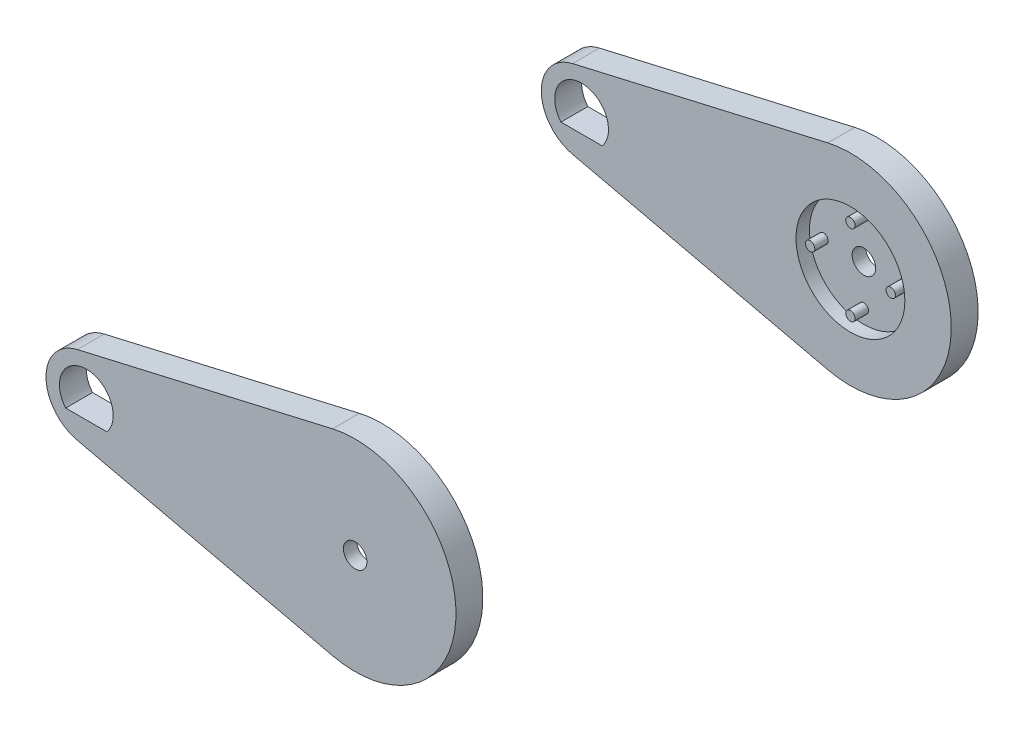
from build123d import *

# Parameters (mm, degrees)
SKETCH1_R           = 15
SKETCH1_R_2         = 8.1
BOSS_EXTRUDE1_DEPTH = 4
SKETCH1_3_R         = 8.1
SKETCH1_3_R_2       = 1.75
BOSS_EXTRUDE2_DEPTH = 2
BOSS_EXTRUDE3_DEPTH = 4
SKETCH3_R           = 0.7
BOSS_EXTRUDE4_DEPTH = 2


with BuildPart() as part:
    # Sketch1 → Boss-Extrude1 (new body)
    with BuildSketch(Plane.XY):
        Circle(SKETCH1_R)
        Circle(SKETCH1_R_2, mode=Mode.SUBTRACT)
    extrude(amount=BOSS_EXTRUDE1_DEPTH)

    # Sketch1<3> → Boss-Extrude2 (add)
    with BuildSketch(Plane.XY):
        Circle(SKETCH1_3_R)
        Circle(SKETCH1_3_R_2, mode=Mode.SUBTRACT)
    extrude(amount=BOSS_EXTRUDE2_DEPTH)

    # Sketch2 → Boss-Extrude3 (add)
    with BuildSketch(Plane.XY):
        with BuildLine():
            Line((-3.375, 14.615381452), (-41.35, 5.846152581))
            ThreePointArc((-41.35, 5.846152581), (-46, 0), (-41.35, -5.846152581))
            Line((-41.35, -5.846152581), (-3.375, -14.615381452))
            ThreePointArc((-3.375, -14.615381452), (-15, 0), (-3.375, 14.615381452))
        make_face()
        with BuildLine():
            Line((-36.925, -2.558197608), (-43.075, -2.558197608))
            ThreePointArc((-43.075, -2.558197608), (-40, 4), (-36.925, -2.558197608))
        make_face(mode=Mode.SUBTRACT)
    extrude(amount=BOSS_EXTRUDE3_DEPTH)


with BuildPart() as body_2:
    # Mirror2: mirrored copy
    add(part.part.mirror(Plane.XY.offset(38.847994838)))


with BuildPart() as part_1:
    add(part.part)

    # Sketch3 → Boss-Extrude4 (add)
    with BuildSketch(Plane.XY.offset(2)):
        with Locations((0, 6)):
            Circle(SKETCH3_R)
        with Locations((6, 0)):
            Circle(SKETCH3_R)
        with Locations((0, -6)):
            Circle(SKETCH3_R)
        with Locations((-6, 0)):
            Circle(SKETCH3_R)
    extrude(amount=BOSS_EXTRUDE4_DEPTH)


solid = Compound([body_2.part, part_1.part])
